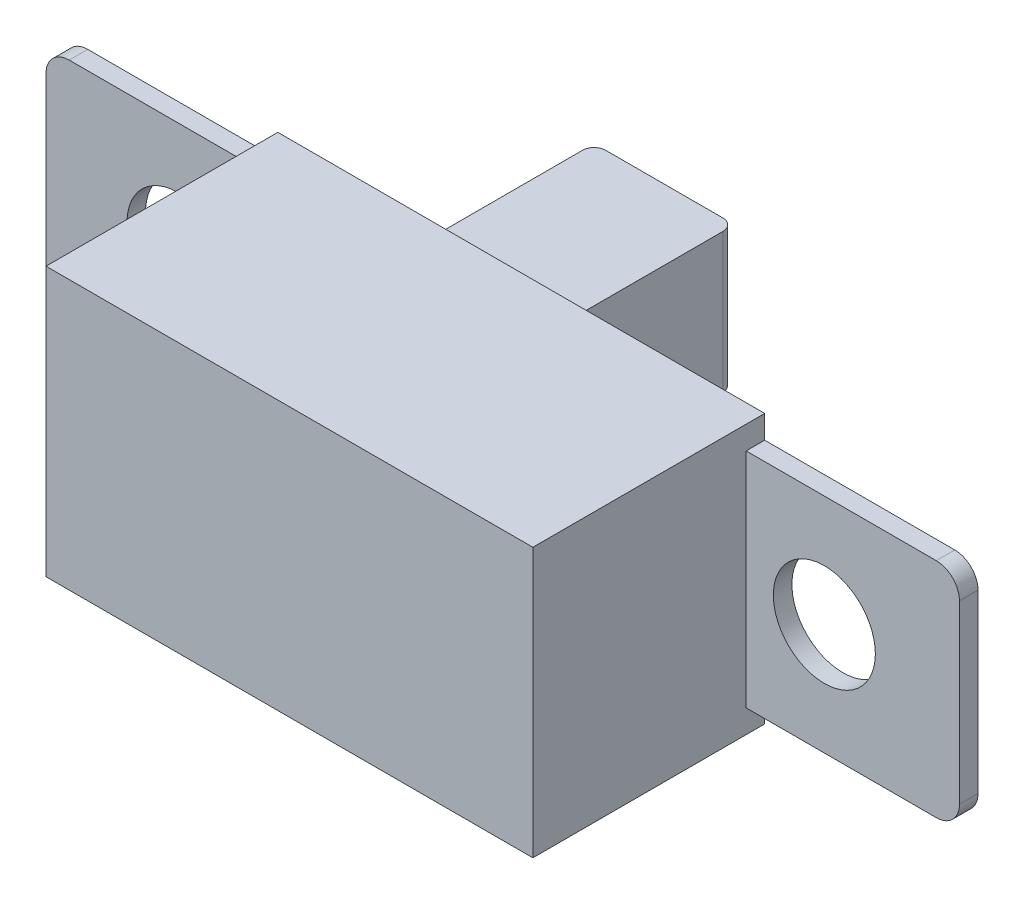
from build123d import *

# Parameters (mm, degrees)
ESQUISSE1_R        = 1.1
ESQUISSE1_W        = 6.844485425
ESQUISSE1_H        = 3
BOSS_EXTRU_1_DEPTH = 0.4
ESQUISSE3_W        = 10.5
ESQUISSE3_H        = 4.6
BOSS_EXTRU_3_DEPTH = 5.8
ESQUISSE4_W        = 3.029083023
ESQUISSE4_H        = 3
BOSS_EXTRU_4_DEPTH = 5
CONG_1_R           = 0.25


with BuildPart() as part:
    # Esquisse1 → Boss.-Extru.1 (new body)
    with BuildSketch(Plane.XY):
        with BuildLine():
            Line((-5.25, -2.9), (5.25, -2.9))
            Line((5.25, -2.9), (5.25, -2.4))
            Line((5.25, -2.4), (9.35, -2.4))
            ThreePointArc((9.35, -2.4), (9.703553391, -2.253553391), (9.85, -1.9))
            Line((9.85, -1.9), (9.85, 1.9))
            ThreePointArc((9.85, 1.9), (9.703553391, 2.253553391), (9.35, 2.4))
            Line((9.35, 2.4), (5.25, 2.4))
            Line((5.25, 2.4), (5.25, 2.9))
            Line((5.25, 2.9), (-5.25, 2.9))
            Line((-5.25, 2.9), (-5.25, 2.4))
            Line((-5.25, 2.4), (-9.35, 2.4))
            ThreePointArc((-9.35, 2.4), (-9.703553391, 2.253553391), (-9.85, 1.9))
            Line((-9.85, 1.9), (-9.85, -1.9))
            ThreePointArc((-9.85, -1.9), (-9.703553391, -2.253553391), (-9.35, -2.4))
            Line((-9.35, -2.4), (-5.25, -2.4))
            Line((-5.25, -2.4), (-5.25, -2.9))
        make_face()
        with Locations((-7.001967481, 0)):
            Circle(ESQUISSE1_R, mode=Mode.SUBTRACT)
        with Locations((6.936303644, 0)):
            Circle(ESQUISSE1_R, mode=Mode.SUBTRACT)
        with Locations((-0.061879176, 0)):
            Rectangle(ESQUISSE1_W, ESQUISSE1_H, mode=Mode.SUBTRACT)
    extrude(amount=BOSS_EXTRU_1_DEPTH)

    # Esquisse3 → Boss.-Extru.3 (add)
    with BuildSketch(Plane(origin=(0, 2.9, 0), x_dir=(1, 0, 0), z_dir=(0, 1, 0))):
        with Locations((0, -2.7)):
            Rectangle(ESQUISSE3_W, ESQUISSE3_H)
    extrude(amount=-BOSS_EXTRU_3_DEPTH)

    # Esquisse4 → Boss.-Extru.4 (add)
    with BuildSketch(Plane(origin=(0, 0, 0.4), x_dir=(-1, 0, 0), z_dir=(0, 0, -1))):
        with Locations((1.514541512, 0)):
            Rectangle(ESQUISSE4_W, ESQUISSE4_H)
    extrude(amount=BOSS_EXTRU_4_DEPTH)

    # Congé1
    cong_1_edges = [part.edges().sort_by_distance(p)[0] for p in [
        (-3.029083023, 0, -4.6),
        (0, 0, -4.6),
    ]]
    fillet(cong_1_edges, radius=CONG_1_R)


solid = part.part
